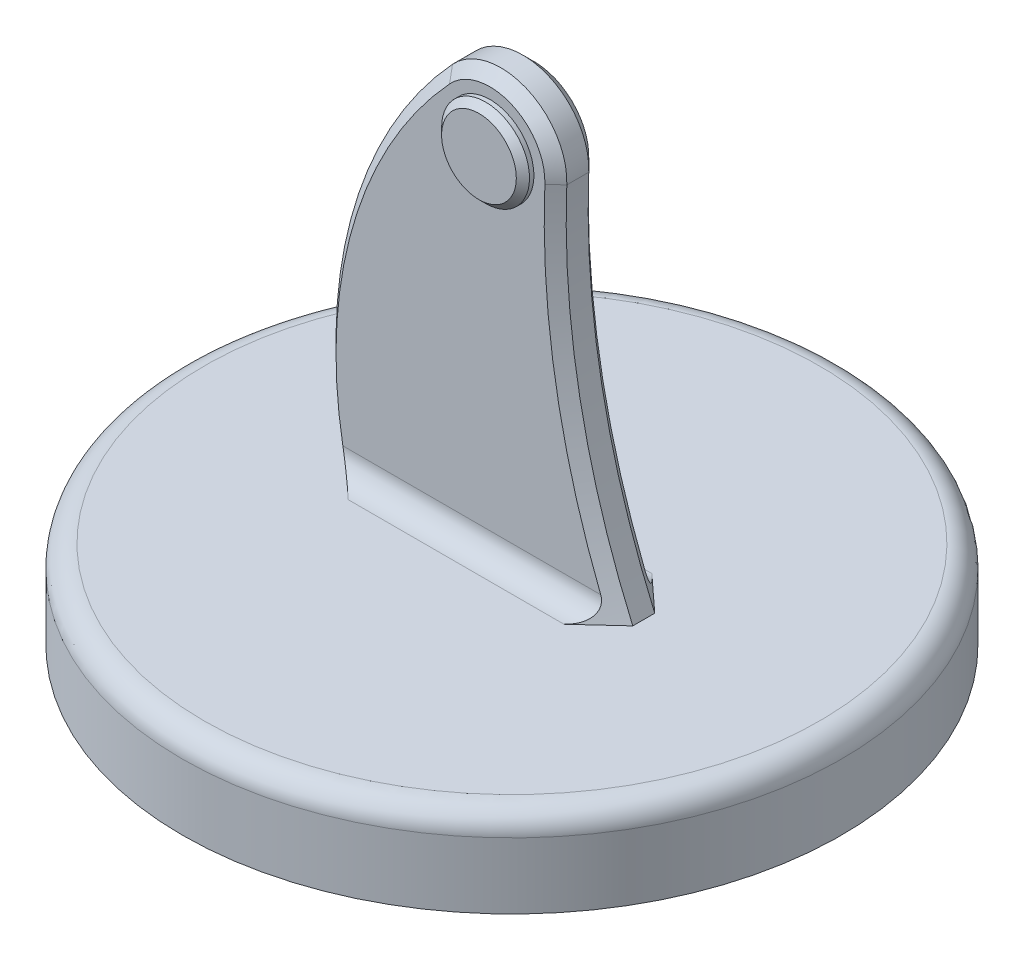
from build123d import *

# Parameters (mm, degrees)
SKETCH2_R           = 75
BOSS_EXTRUDE1_DEPTH = 20
FILLET1_R           = 5
BOSS_EXTRUDE2_DEPTH = 5
CHAMFER14_SIZE      = 2.5
CHAMFER15_SIZE      = 2.5
FILLET4_R           = 5
FILLET5_R           = 5
SKETCH4_R           = 10
BOSS_EXTRUDE8_DEPTH = 2.5
SKETCH5_R           = 5
CUT_EXTRUDE1_DEPTH  = 10
CHAMFER24_SIZE      = 1.5


with BuildPart() as part:
    # Sketch2 → Boss-Extrude1 (new body)
    with BuildSketch(Plane(origin=(0, 0, 0), x_dir=(1, 0, 0), z_dir=(0, 1, 0))):
        with Locations(Location((0, 0, 0), (0, 0, 270))):
            Circle(SKETCH2_R)
    extrude(amount=BOSS_EXTRUDE1_DEPTH)

    # Fillet1
    fillet1_edges = [part.edges().sort_by_distance(p)[0] for p in [
        (0, 20, -75),
    ]]
    fillet(fillet1_edges, radius=FILLET1_R)

    # Sketch3 → Boss-Extrude2 (add, symmetric)
    with BuildSketch(Plane.XY):
        with BuildLine():
            Line((-35, 20), (30, 20))
            ThreePointArc((30, 20), (17.980206761, 58.849975441), (14.988260139, 99.406655245))
            ThreePointArc((14.988260139, 99.406655245), (5.736147111, 113.859892363), (-11.023885447, 110.172214589))
            ThreePointArc((-11.023885447, 110.172214589), (-34.173411443, 68.05385799), (-35, 20))
        make_face()
    extrude(amount=BOSS_EXTRUDE2_DEPTH, both=True)

    # Chamfer14
    chamfer14_edges = [part.edges().sort_by_distance(p)[0] for p in [
        (-34.173411443, 68.05385799, -5),
        (17.980206761, 58.849975441, -5),
        (5.736147111, 113.859892363, -5),
    ]]
    chamfer(chamfer14_edges, length=CHAMFER14_SIZE)

    # Chamfer15
    chamfer15_edges = [part.edges().sort_by_distance(p)[0] for p in [
        (-34.173411443, 68.05385799, 5),
        (17.980206761, 58.849975441, 5),
        (5.736147111, 113.859892363, 5),
    ]]
    chamfer(chamfer15_edges, length=CHAMFER15_SIZE)

    # Fillet4
    fillet4_edges = [part.edges().sort_by_distance(p)[0] for p in [
        (-2.579776455, 20, 5),
    ]]
    fillet(fillet4_edges, radius=FILLET4_R)

    # Fillet5
    fillet5_edges = [part.edges().sort_by_distance(p)[0] for p in [
        (-2.579776455, 20, -5),
    ]]
    fillet(fillet5_edges, radius=FILLET5_R)

    # Sketch4 → Boss-Extrude8 (add, symmetric)
    with BuildSketch(Plane.XY.offset(5)):
        with Locations(Location((0, 100, 0), (0, 0, 180))):
            Circle(SKETCH4_R)
    extrude(amount=BOSS_EXTRUDE8_DEPTH, both=True)

    # Sketch5 → Cut-Extrude1 (cut)
    with BuildSketch(Plane(origin=(0, 0, -5), x_dir=(-1, 0, 0), z_dir=(0, 0, -1))):
        with Locations((0, 100)):
            Circle(SKETCH5_R)
    extrude(amount=-CUT_EXTRUDE1_DEPTH, mode=Mode.SUBTRACT)

    # Chamfer24
    chamfer24_edges = [part.edges().sort_by_distance(p)[0] for p in [
        (10, 100, 7.5),
    ]]
    chamfer(chamfer24_edges, length=CHAMFER24_SIZE)


solid = part.part
